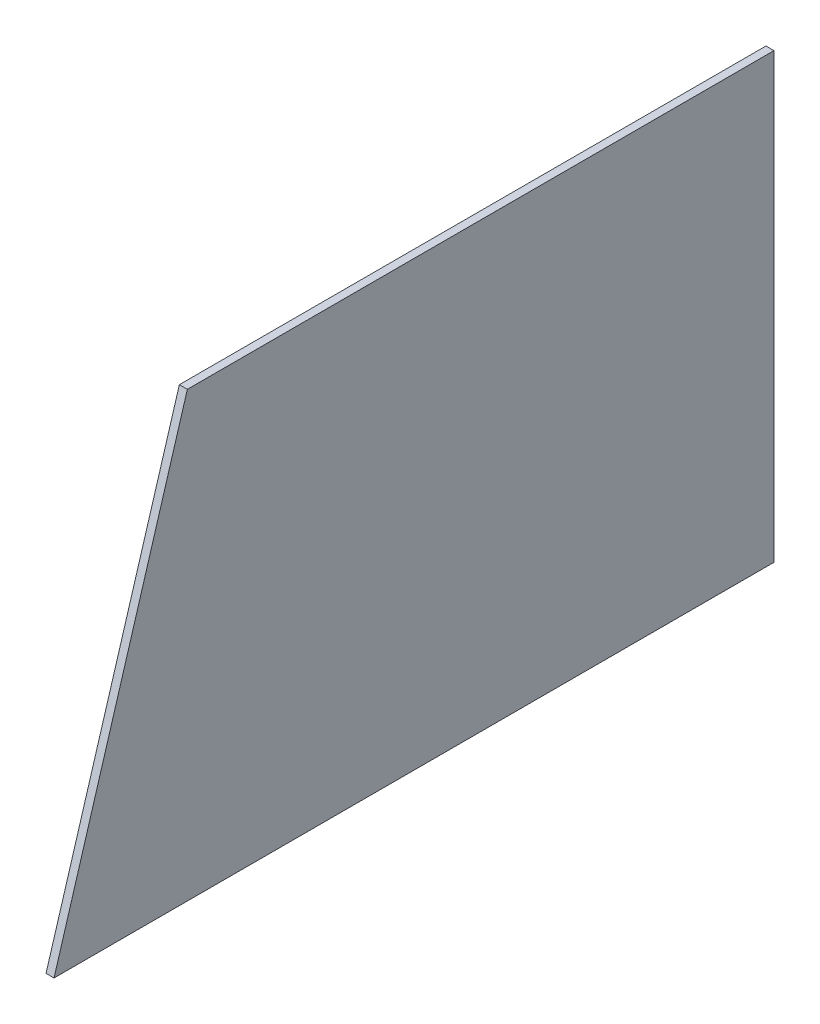
from build123d import *

# Parameters (mm, degrees)
BOSS_EXTRUDE1_DEPTH = 3


with BuildPart() as part:
    # Sketch1 → Boss-Extrude1 (new body)
    with BuildSketch(Plane(origin=(0, 0, 0), x_dir=(0, 0, -1), z_dir=(1, 0, 0))):
        Polygon((-220, 67.472112247), (0, 67.472112247), (0, -98.735589139), (-270, -98.735589139), align=None)
    extrude(amount=BOSS_EXTRUDE1_DEPTH)


solid = part.part
